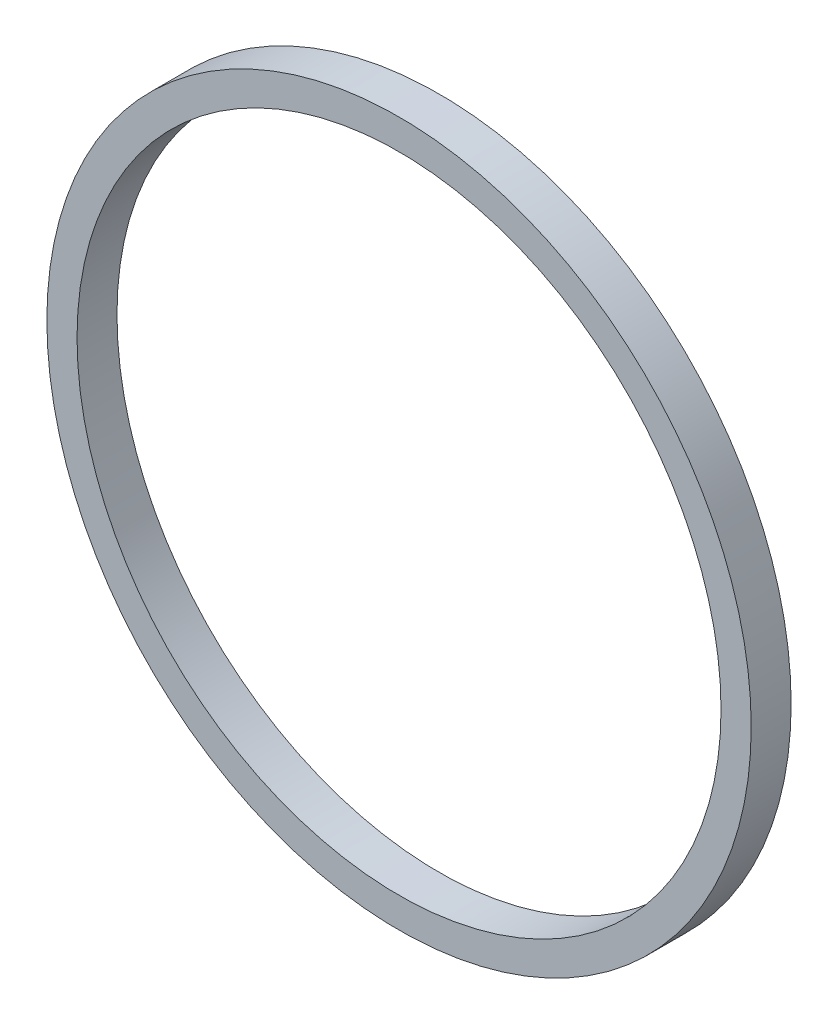
from build123d import *

# Parameters (mm, degrees)
SKETCH1_R           = 17.5
SKETCH1_R_2         = 16
BOSS_EXTRUDE1_DEPTH = 1.984375


with BuildPart() as part:
    # Sketch1 → Boss-Extrude1 (new body)
    with BuildSketch(Plane.XY):
        Circle(SKETCH1_R)
        Circle(SKETCH1_R_2, mode=Mode.SUBTRACT)
    extrude(amount=BOSS_EXTRUDE1_DEPTH)


solid = part.part
